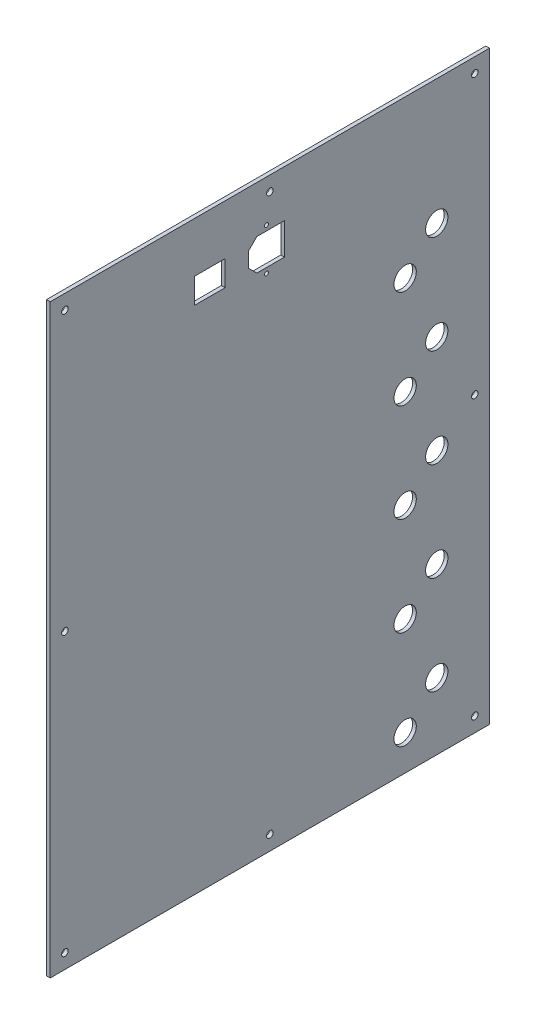
from build123d import *

# Parameters (mm, degrees)
SKETCH1_W           = 500
SKETCH1_H           = 375
SKETCH1_R           = 2.8
BOSS_EXTRUDE1_DEPTH = 3.175
SKETCH2_R           = 9.525
CUT_EXTRUDE1_DEPTH  = 313.516128584
CUT_EXTRUDE2_DEPTH  = 313.516128584
SKETCH5_R           = 1.7
CUT_EXTRUDE3_DEPTH  = 313.516128584
SKETCH6_W           = 21.5
SKETCH6_H           = 26
CUT_EXTRUDE4_DEPTH  = 313.516128584


with BuildPart() as part:
    # Sketch1 → Boss-Extrude1 (new body)
    with BuildSketch(Plane.YZ):
        Rectangle(SKETCH1_W, SKETCH1_H)
        with Locations(Location((-237.5, 175, 0), (0, 0, 270))):
            Circle(SKETCH1_R, mode=Mode.SUBTRACT)
        with Locations(Location((237.5, 175, 0), (0, 0, 270))):
            Circle(SKETCH1_R, mode=Mode.SUBTRACT)
        with Locations(Location((237.5, -175, 0), (0, 0, 270))):
            Circle(SKETCH1_R, mode=Mode.SUBTRACT)
        with Locations(Location((-237.5, -175, 0), (0, 0, 270))):
            Circle(SKETCH1_R, mode=Mode.SUBTRACT)
        with Locations(Location((-237.5, 0, 0), (0, 0, 270))):
            Circle(SKETCH1_R, mode=Mode.SUBTRACT)
        with Locations(Location((0, 175, 0), (0, 0, 270))):
            Circle(SKETCH1_R, mode=Mode.SUBTRACT)
        with Locations(Location((237.5, 0, 0), (0, 0, 270))):
            Circle(SKETCH1_R, mode=Mode.SUBTRACT)
        with Locations(Location((0, -175, 0), (0, 0, 270))):
            Circle(SKETCH1_R, mode=Mode.SUBTRACT)
    extrude(amount=BOSS_EXTRUDE1_DEPTH)

    # Sketch2 → Cut-Extrude1 (cut, through all)
    with BuildSketch(Plane.YZ.offset(3.175)):
        with Locations(Location((-220, -115.5, 0), (0, 0, 270))):
            Circle(SKETCH2_R)
        with Locations(Location((-193, -142.5, 0), (0, 0, 270))):
            Circle(SKETCH2_R)
        with Locations(Location((-136, -115.5, 0), (0, 0, 270))):
            Circle(SKETCH2_R)
        with Locations(Location((-109, -142.5, 0), (0, 0, 270))):
            Circle(SKETCH2_R)
        with Locations(Location((-52, -115.5, 0), (0, 0, 270))):
            Circle(SKETCH2_R)
        with Locations(Location((-25, -142.5, 0), (0, 0, 270))):
            Circle(SKETCH2_R)
        with Locations(Location((32, -115.5, 0), (0, 0, 270))):
            Circle(SKETCH2_R)
        with Locations(Location((59, -142.5, 0), (0, 0, 270))):
            Circle(SKETCH2_R)
        with Locations(Location((116, -115.5, 0), (0, 0, 270))):
            Circle(SKETCH2_R)
        with Locations(Location((143, -142.5, 0), (0, 0, 270))):
            Circle(SKETCH2_R)
    extrude(amount=-CUT_EXTRUDE1_DEPTH, mode=Mode.SUBTRACT)

    # Sketch4 → Cut-Extrude2 (cut, through all)
    with BuildSketch(Plane.YZ.offset(3.175)):
        Polygon((210, -12.5), (183, -12.5), (183, 11.122), (190.112, 18.234), (202.888, 18.234), (210, 11.122), align=None)
    extrude(amount=-CUT_EXTRUDE2_DEPTH, mode=Mode.SUBTRACT)

    # Sketch5 → Cut-Extrude3 (cut, through all)
    with BuildSketch(Plane.YZ.offset(3.175)):
        with Locations(Location((178.593, 2.9, 0), (0, 0, 270))):
            Circle(SKETCH5_R)
        with Locations(Location((214.407, 2.9, 0), (0, 0, 270))):
            Circle(SKETCH5_R)
    extrude(amount=-CUT_EXTRUDE3_DEPTH, mode=Mode.SUBTRACT)

    # Sketch6 → Cut-Extrude4 (cut, through all)
    with BuildSketch(Plane.YZ.offset(3.175)):
        with Locations((196.5, 51.234)):
            Rectangle(SKETCH6_W, SKETCH6_H)
    extrude(amount=-CUT_EXTRUDE4_DEPTH, mode=Mode.SUBTRACT)


solid = part.part
